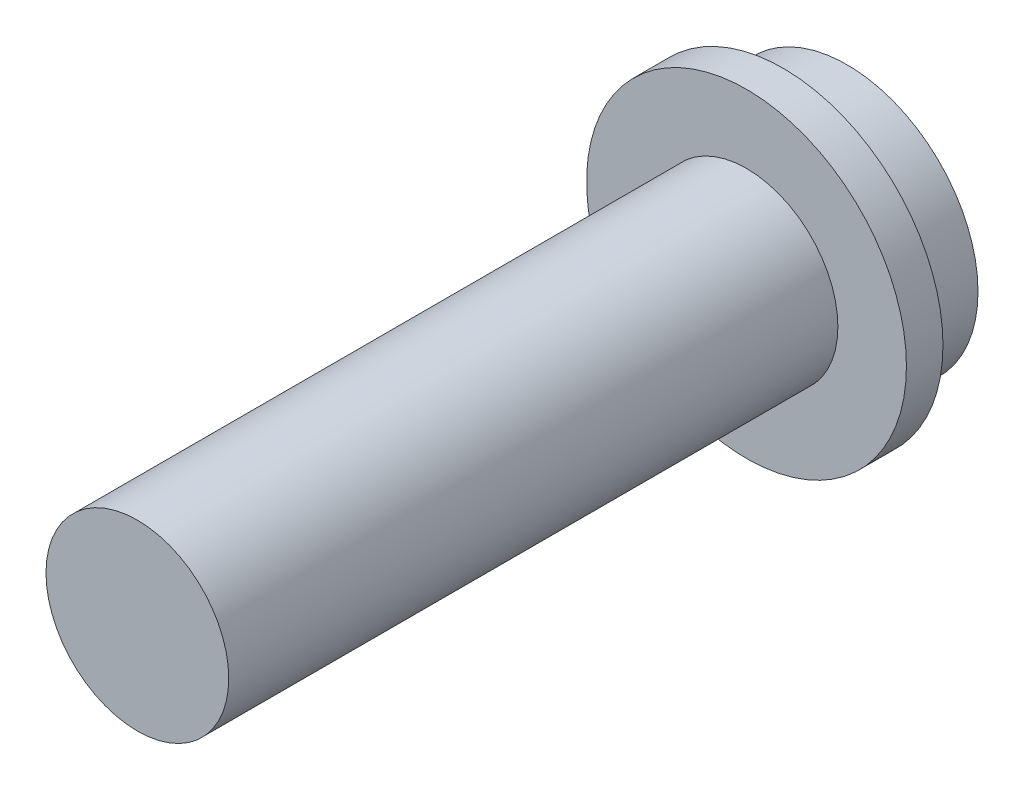
from build123d import *

# Parameters (mm, degrees)
S01_M6_SHANK_R                   = 3
F_01_M6_SHANK_DEPTH              = 20
F_02_START                       = -1.2
S02_HEAD_SEATING_DIAMETER_R      = 5.25
F_02_HEAD_SEATING_DIAMETER_DEPTH = 1.2
F_03_START                       = -3.3
S03_BUTTON_CROWN_R               = 4.3
F_03_BUTTON_CROWN_DEPTH          = 2.1
F_04_START                       = -3.4
F_04_4_MM_HEX_KEY_DEPTH          = 2.2


with BuildPart() as part:
    # S01 - M6 shank → 01 - M6 shank (new body)
    with BuildSketch(Plane.XY):
        Circle(S01_M6_SHANK_R)
    extrude(amount=F_01_M6_SHANK_DEPTH)

    # S02 - Head seating diameter → 02 - Head seating diameter (add)
    with BuildSketch(Plane.XY.offset(F_02_START)):
        Circle(S02_HEAD_SEATING_DIAMETER_R)
    extrude(amount=F_02_HEAD_SEATING_DIAMETER_DEPTH)

    # S03 - Button crown → 03 - Button crown (add)
    with BuildSketch(Plane.XY.offset(F_03_START)):
        Circle(S03_BUTTON_CROWN_R)
    extrude(amount=F_03_BUTTON_CROWN_DEPTH)

    # S04 - 4 mm hex key → 04 - 4 mm hex key (cut)
    with BuildSketch(Plane.XY.offset(F_04_START)):
        Polygon((2.309401077, 0), (1.154700538, 2), (-1.154700538, 2), (-2.309401077, 0), (-1.154700538, -2), (1.154700538, -2), align=None)
    extrude(amount=F_04_4_MM_HEX_KEY_DEPTH, mode=Mode.SUBTRACT)


solid = part.part
